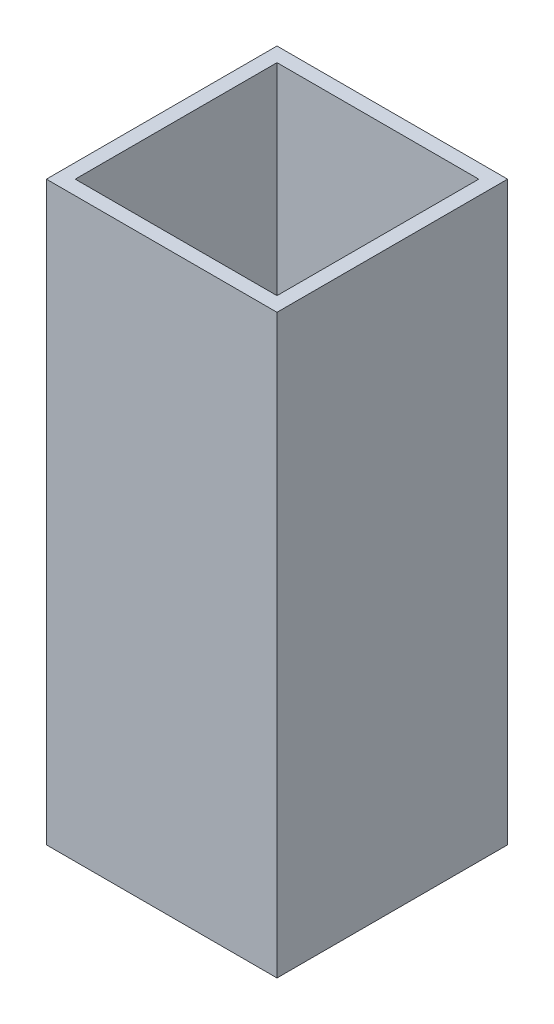
from build123d import *

# Parameters (mm, degrees)
SKETCH1_W           = 25.4
SKETCH1_H           = 25.4
SKETCH1_W_2         = 22.225
SKETCH1_H_2         = 22.225
BOSS_EXTRUDE1_DEPTH = 63.5


with BuildPart() as part:
    # Sketch1 → Boss-Extrude1 (new body)
    with BuildSketch(Plane(origin=(0, 0, 0), x_dir=(1, 0, 0), z_dir=(0, 1, 0))):
        Rectangle(SKETCH1_W, SKETCH1_H)
        Rectangle(SKETCH1_W_2, SKETCH1_H_2, mode=Mode.SUBTRACT)
    extrude(amount=BOSS_EXTRUDE1_DEPTH)


solid = part.part
